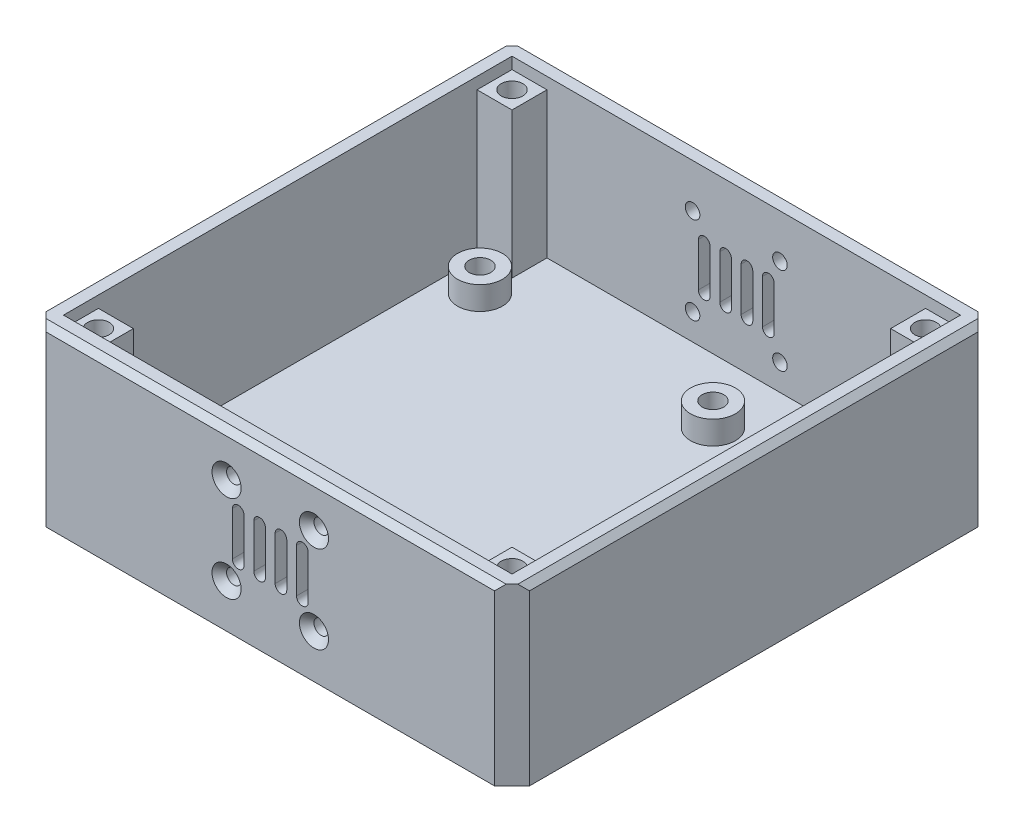
from build123d import *

# Parameters (mm, degrees)
SKETCH3_W              = 83
SKETCH3_H              = 83
BODY_DEPTH             = 15
SHELL_T                = -3
SKETCH4_W              = 6
SKETCH4_H              = 6
SKETCH4_R              = 1.85
INSERTS_SUPPPORT_DEPTH = 25
CHAMFER1_SIZE          = 3
CHAMFER2_SIZE          = 1
SKETCH5_R              = 1.25
AIR_EXTRACTION_DEPTH   = 95.001329778
CHAMFER3_SIZE          = 1.25
SKETCH7_R              = 3.85
SKETCH7_R_2            = 1.85
BOSS_EXTRUDE1_DEPTH    = 4


with BuildPart() as part:
    # Sketch3 → Body (new, symmetric)
    with BuildSketch(Plane(origin=(0, 0, 0), x_dir=(1, 0, 0), z_dir=(0, 1, 0))):
        Rectangle(SKETCH3_W, SKETCH3_H)
    extrude(amount=BODY_DEPTH, both=True)

    # Shell
    shell_openings = [part.faces().sort_by_distance(p)[0] for p in [
        (0, 15, 0),
    ]]
    offset(amount=SHELL_T, openings=shell_openings, kind=Kind.INTERSECTION)

    # Sketch4 → Inserts_Suppport (add)
    # profile 1 of 4: a face of its own
    with BuildSketch(Plane(origin=(0, -12, 0), x_dir=(1, 0, 0), z_dir=(0, 1, 0))):
        with Locations((-35.5, 35.5)):
            Rectangle(SKETCH4_W, SKETCH4_H)
        with Locations(Location((-35.5, 35.5, 0), (0, 0, 270))):
            Circle(SKETCH4_R, mode=Mode.SUBTRACT)
    # profile 2 of 4: a face of its own
    with BuildSketch(Plane(origin=(0, -12, 0), x_dir=(1, 0, 0), z_dir=(0, 1, 0))):
        with Locations((35.5, 35.5)):
            Rectangle(SKETCH4_W, SKETCH4_H)
        with Locations(Location((35.5, 35.5, 0), (0, 0, 270))):
            Circle(SKETCH4_R, mode=Mode.SUBTRACT)
    # profile 3 of 4: a face of its own
    with BuildSketch(Plane(origin=(0, -12, 0), x_dir=(1, 0, 0), z_dir=(0, 1, 0))):
        with Locations((35.5, -35.5)):
            Rectangle(SKETCH4_W, SKETCH4_H)
        with Locations(Location((35.5, -35.5, 0), (0, 0, 270))):
            Circle(SKETCH4_R, mode=Mode.SUBTRACT)
    # profile 4 of 4: a face of its own
    with BuildSketch(Plane(origin=(0, -12, 0), x_dir=(1, 0, 0), z_dir=(0, 1, 0))):
        with Locations((-35.5, -35.5)):
            Rectangle(SKETCH4_W, SKETCH4_H)
        with Locations(Location((-35.5, -35.5, 0), (0, 0, 270))):
            Circle(SKETCH4_R, mode=Mode.SUBTRACT)
    extrude(amount=INSERTS_SUPPPORT_DEPTH)

    # Chamfer1
    chamfer1_edges = [part.edges().sort_by_distance(p)[0] for p in [
        (-41.5, 0, -41.5),
        (41.5, 0, -41.5),
        (41.5, 0, 41.5),
        (-41.5, 0, 41.5),
    ]]
    chamfer(chamfer1_edges, length=CHAMFER1_SIZE)

    # Chamfer2
    chamfer2_edges = [part.edges().sort_by_distance(p)[0] for p in [
        (0, 15, 41.5),
        (-41.5, 15, 0),
        (41.5, 15, 0),
        (0, 15, -41.5),
    ]]
    chamfer(chamfer2_edges, length=CHAMFER2_SIZE)

    # Sketch5 → Air_Extraction (cut, through all)
    with BuildSketch(Plane.XY.offset(41.5)):
        with Locations((-7.5, 7.5)):
            Circle(SKETCH5_R)
        with Locations((-7.5, -7.5)):
            Circle(SKETCH5_R)
        with Locations((7.5, -7.5)):
            Circle(SKETCH5_R)
        with Locations((7.5, 7.5)):
            Circle(SKETCH5_R)
        with BuildLine():
            Line((-4.5, 3.75), (-4.5, -3.75))
            ThreePointArc((-4.5, -3.75), (-5.5, -4.75), (-6.5, -3.75))
            Line((-6.5, -3.75), (-6.5, 3.75))
            ThreePointArc((-6.5, 3.75), (-5.5, 4.75), (-4.5, 3.75))
        make_face()
        with BuildLine():
            Line((-0.833333333, 3.75), (-0.833333333, -3.75))
            ThreePointArc((-0.833333333, -3.75), (-1.833333333, -4.75), (-2.833333333, -3.75))
            Line((-2.833333333, -3.75), (-2.833333333, 3.75))
            ThreePointArc((-2.833333333, 3.75), (-1.833333333, 4.75), (-0.833333333, 3.75))
        make_face()
        with BuildLine():
            Line((2.833333333, 3.75), (2.833333333, -3.75))
            ThreePointArc((2.833333333, -3.75), (1.833333333, -4.75), (0.833333333, -3.75))
            Line((0.833333333, -3.75), (0.833333333, 3.75))
            ThreePointArc((0.833333333, 3.75), (1.833333333, 4.75), (2.833333333, 3.75))
        make_face()
        with BuildLine():
            Line((6.5, 3.75), (6.5, -3.75))
            ThreePointArc((6.5, -3.75), (5.5, -4.75), (4.5, -3.75))
            Line((4.5, -3.75), (4.5, 3.75))
            ThreePointArc((4.5, 3.75), (5.5, 4.75), (6.5, 3.75))
        make_face()
    extrude(amount=-AIR_EXTRACTION_DEPTH, mode=Mode.SUBTRACT)

    # Chamfer3
    chamfer3_edges = [part.edges().sort_by_distance(p)[0] for p in [
        (6.25, 7.5, -41.5),
        (6.25, 7.5, 41.5),
        (6.25, -7.5, -41.5),
        (6.25, -7.5, 41.5),
        (-8.75, 7.5, -41.5),
        (-8.75, 7.5, 41.5),
        (-8.75, -7.5, -41.5),
        (-8.75, -7.5, 41.5),
    ]]
    chamfer(chamfer3_edges, length=CHAMFER3_SIZE)

    # Sketch7 → Boss-Extrude1 (add)
    # profile 1 of 4: a face of its own
    with BuildSketch(Plane(origin=(0, -12, 0), x_dir=(1, 0, 0), z_dir=(0, 1, 0))):
        with Locations(Location((7, 27.5, 0), (0, 0, 270))):
            Circle(SKETCH7_R)
        with Locations(Location((7, 27.5, 0), (0, 0, 270))):
            Circle(SKETCH7_R_2, mode=Mode.SUBTRACT)
    # profile 2 of 4: a face of its own
    with BuildSketch(Plane(origin=(0, -12, 0), x_dir=(1, 0, 0), z_dir=(0, 1, 0))):
        with Locations(Location((-33, 27.5, 0), (0, 0, 270))):
            Circle(SKETCH7_R)
        with Locations(Location((-33, 27.5, 0), (0, 0, 270))):
            Circle(SKETCH7_R_2, mode=Mode.SUBTRACT)
    # profile 3 of 4: a face of its own
    with BuildSketch(Plane(origin=(0, -12, 0), x_dir=(1, 0, 0), z_dir=(0, 1, 0))):
        with Locations(Location((-33, -27.5, 0), (0, 0, 270))):
            Circle(SKETCH7_R)
        with Locations(Location((-33, -27.5, 0), (0, 0, 270))):
            Circle(SKETCH7_R_2, mode=Mode.SUBTRACT)
    # profile 4 of 4: a face of its own
    with BuildSketch(Plane(origin=(0, -12, 0), x_dir=(1, 0, 0), z_dir=(0, 1, 0))):
        with Locations(Location((7, -27.5, 0), (0, 0, 270))):
            Circle(SKETCH7_R)
        with Locations(Location((7, -27.5, 0), (0, 0, 270))):
            Circle(SKETCH7_R_2, mode=Mode.SUBTRACT)
    extrude(amount=BOSS_EXTRUDE1_DEPTH)


solid = part.part
